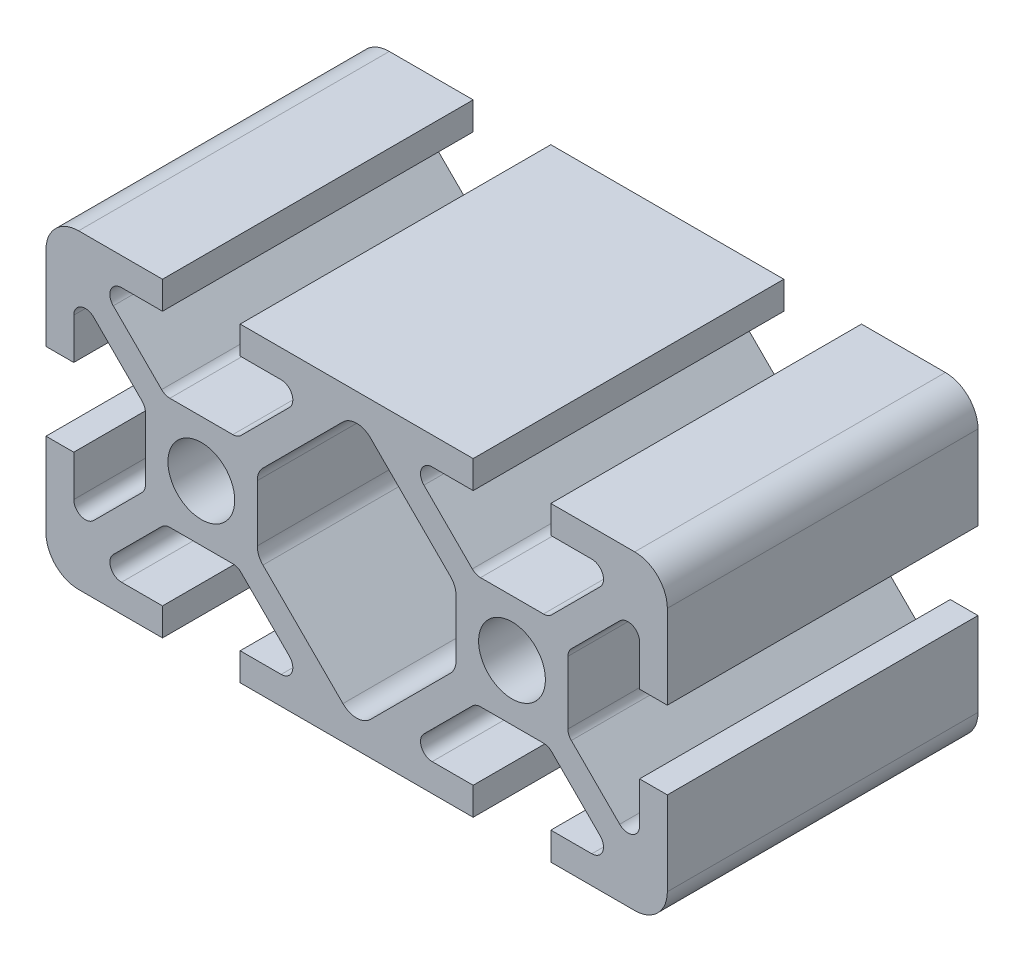
from build123d import *

# Parameters (mm, degrees)
BOSS_EXTRUDE1_DEPTH = 1524
BOSS_EXTRUDE2_DEPTH = 1524
FILLET1_R           = 0.75
FILLET2_R           = 1.25
SKETCH5_W           = 3028
SKETCH5_H           = 20
CUT_EXTRUDE1_DEPTH  = 1525.55764076


with BuildPart() as part:
    # Sketch3 → Boss-Extrude1 (new, symmetric)
    with BuildSketch(Plane.XY):
        with BuildLine():
            Line((12.5, -10), (17.9, -10))
            ThreePointArc((17.9, -10), (19.38492424, -9.38492424), (20, -7.9))
            Line((20, -7.9), (20, -2.5))
            Line((20, -2.5), (18.213351365, -2.5))
            Line((18.213351365, -2.5), (18.213351365, -6.95))
            Line((18.213351365, -6.95), (13.6, -2.336648635))
            Line((13.6, -2.336648635), (13.6, 0))
            Line((13.6, 0), (12.15, 0))
            ThreePointArc((12.15, 0), (11.52027958, -1.52027958), (10, -2.15))
            Line((10, -2.15), (10, -3.6))
            Line((10, -3.6), (12.336648635, -3.6))
            Line((12.336648635, -3.6), (16.95, -8.213351365))
            Line((16.95, -8.213351365), (12.5, -8.213351365))
            Line((12.5, -8.213351365), (12.5, -10))
        make_face()
    extrude(amount=BOSS_EXTRUDE1_DEPTH, both=True)

    # Sketch4 → Boss-Extrude2 (add, symmetric)
    with BuildSketch(Plane.XY):
        with BuildLine():
            Line((10, -3.6), (7.663351365, -3.6))
            Line((7.663351365, -3.6), (3.05, -8.213351365))
            Line((3.05, -8.213351365), (7.5, -8.213351365))
            Line((7.5, -8.213351365), (7.5, -10))
            Line((7.5, -10), (0, -10))
            Line((0, -10), (0, -8.736648635))
            Line((0, -8.736648635), (6.4, -2.336648635))
            Line((6.4, -2.336648635), (6.4, 0))
            Line((6.4, 0), (7.85, 0))
            ThreePointArc((7.85, 0), (8.47972042, -1.52027958), (10, -2.15))
            Line((10, -2.15), (10, -3.6))
        make_face()
    extrude(amount=BOSS_EXTRUDE2_DEPTH, both=True)

    # Mirror1: part across plane


with BuildPart() as part_1:
    add(part.part)
    add(part.part.mirror(Plane(origin=(0, 0, 0), x_dir=(0, 0, 1), z_dir=(1, 0, 0))))

    # Mirror2: part across plane


with BuildPart() as part_2:
    add(part_1.part)
    add(part_1.part.mirror(Plane.ZX))

    # Fillet1
    fillet1_edges = [part_2.edges().sort_by_distance(p)[0] for p in [
        (18.213351365, 6.95, 0),
        (13.6, 2.336648635, 0),
        (12.336648635, 3.6, 0),
        (16.95, 8.213351365, 0),
        (3.05, 8.213351365, 0),
        (7.663351365, 3.6, 0),
        (-18.213351365, 6.95, 0),
        (-13.6, 2.336648635, 0),
        (-7.663351365, 3.6, 0),
        (-12.336648635, 3.6, 0),
        (-16.95, 8.213351365, 0),
        (-3.05, 8.213351365, 0),
        (16.95, -8.213351365, 0),
        (12.336648635, -3.6, 0),
        (13.6, -2.336648635, 0),
        (18.213351365, -6.95, 0),
        (3.05, -8.213351365, 0),
        (7.663351365, -3.6, 0),
        (-18.213351365, -6.95, 0),
        (-13.6, -2.336648635, 0),
        (-12.336648635, -3.6, 0),
        (-16.95, -8.213351365, 0),
        (-3.05, -8.213351365, 0),
        (-7.663351365, -3.6, 0),
    ]]
    fillet(fillet1_edges, radius=FILLET1_R)

    # Fillet2
    fillet2_edges = [part_2.edges().sort_by_distance(p)[0] for p in [
        (6.4, 2.336648635, 0),
        (0, 8.736648635, 0),
        (-6.4, 2.336648635, 0),
        (6.4, -2.336648635, 0),
        (-6.4, -2.336648635, 0),
        (0, -8.736648635, 0),
    ]]
    fillet(fillet2_edges, radius=FILLET2_R)

    # Sketch5 → Cut-Extrude1 (cut, through all)
    with BuildSketch(Plane(origin=(20, 0, 0), x_dir=(0, 0, -1), z_dir=(1, 0, 0))):
        with Locations((10, 0)):
            Rectangle(SKETCH5_W, SKETCH5_H)
    extrude(amount=-CUT_EXTRUDE1_DEPTH, mode=Mode.SUBTRACT)


solid = part_2.part
